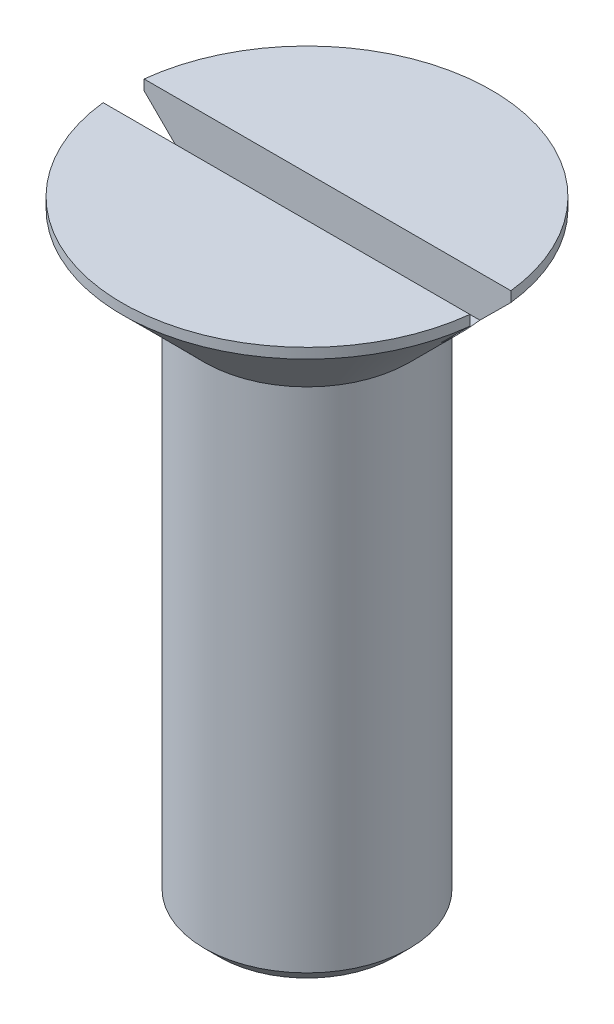
from build123d import *

# Parameters (mm, degrees)
SKETCH_13_W         = 19
SKETCH_13_H         = 2
CUT_EXTRUDE_9_DEPTH = 2
CHAMFER_1_SIZE      = 0.75


with BuildPart() as part:
    # Эскиз1 → Повернуть1 (revolve)
    with BuildSketch(Plane.XY):
        Polygon((0, 30), (0, 0), (5, 0), (5, 25.5), (9, 29.5), (9, 30), align=None)
    revolve(axis=Axis((0, 125.763182898, 0), (0, -1, 0)))

    # Эскиз13 → Вырез-Вытянуть9 (cut)
    with BuildSketch(Plane(origin=(0, 30, 0), x_dir=(-1, 0, 0), z_dir=(0, 1, 0))):
        Rectangle(SKETCH_13_W, SKETCH_13_H)
    extrude(amount=-CUT_EXTRUDE_9_DEPTH, mode=Mode.SUBTRACT)

    # Фаска1
    chamfer_1_edges = [part.edges().sort_by_distance(p)[0] for p in [
        (-5, 0, 0),
    ]]
    chamfer(chamfer_1_edges, length=CHAMFER_1_SIZE)


solid = part.part
